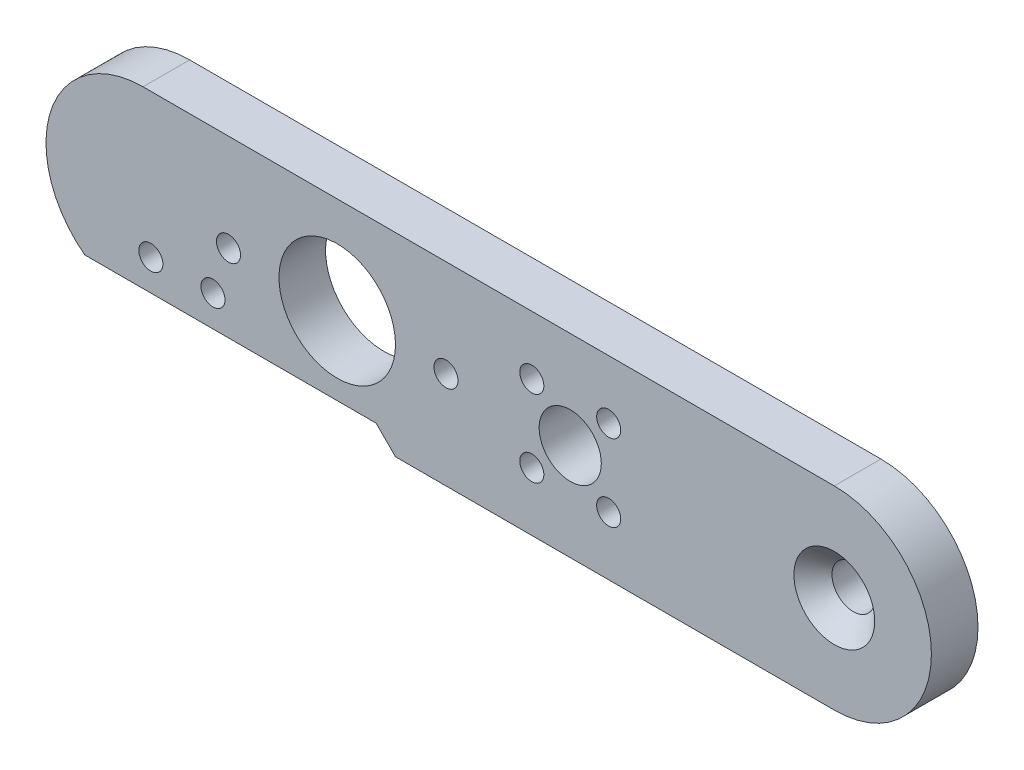
from build123d import *

# Parameters (mm, degrees)
SKETCH1_R                                       = 4
SKETCH1_R_2                                     = 1.55
SKETCH1_R_3                                     = 7.5
BOSS_EXTRUDE1_DEPTH                             = 6
CSK_FOR_M5_FLAT_HEAD_MACHINE_SCREW1_D           = 5.5
CSK_FOR_M5_FLAT_HEAD_MACHINE_SCREW1_CSINK_D     = 10.4
CSK_FOR_M5_FLAT_HEAD_MACHINE_SCREW1_CSINK_ANGLE = 90
SKETCH4_R                                       = 1.55
SKETCH4_R_2                                     = 7.5
CUT_EXTRUDE1_DEPTH                              = 59.662168388
SKETCH6_R                                       = 3
CUT_EXTRUDE3_DEPTH                              = 3


with BuildPart() as part:
    # Sketch1 → Boss-Extrude1 (new body)
    with BuildSketch(Plane.XY):
        with BuildLine():
            Line((-44.5, 12.5), (44.5, 12.5))
            ThreePointArc((44.5, 12.5), (57, 0), (44.5, -12.5))
            Line((44.5, -12.5), (-12, -12.5))
            Line((-12, -12.5), (-14.5, -10))
            Line((-14.5, -10), (-52, -10))
            ThreePointArc((-52, -10), (-56.358541226, 3.952847075), (-44.5, 12.5))
        make_face()
        with Locations((10.5, 0)):
            Circle(SKETCH1_R, mode=Mode.SUBTRACT)
        with Locations((15.449747468, 4.949747468)):
            Circle(SKETCH1_R_2, mode=Mode.SUBTRACT)
        with Locations(Location((5.550252532, 4.949747468, 0), (0, 0, 180))):
            Circle(SKETCH1_R_2, mode=Mode.SUBTRACT)
        with Locations((5.550252532, -4.949747468)):
            Circle(SKETCH1_R_2, mode=Mode.SUBTRACT)
        with Locations((15.449747468, -4.949747468)):
            Circle(SKETCH1_R_2, mode=Mode.SUBTRACT)
        with Locations((-33.5, 0)):
            Circle(SKETCH1_R_2, mode=Mode.SUBTRACT)
        with Locations((-19.5, 0)):
            Circle(SKETCH1_R_3, mode=Mode.SUBTRACT)
        with Locations((-5.5, 0)):
            Circle(SKETCH1_R_2, mode=Mode.SUBTRACT)
    extrude(amount=BOSS_EXTRUDE1_DEPTH)

    # CSK for M5 Flat Head Machine Screw1 (through all)
    with Locations(Plane.XY.offset(6)):
        with Locations((44.5, 0)):
            CounterSinkHole(CSK_FOR_M5_FLAT_HEAD_MACHINE_SCREW1_D / 2, CSK_FOR_M5_FLAT_HEAD_MACHINE_SCREW1_CSINK_D / 2, counter_sink_angle=CSK_FOR_M5_FLAT_HEAD_MACHINE_SCREW1_CSINK_ANGLE)

    # Sketch4 → Cut-Extrude1 (cut, through all)
    with BuildSketch(Plane.XY.offset(6)):
        with Locations((-43.5, -6)):
            Circle(SKETCH4_R)
        with Locations((-35.5, -6)):
            Circle(SKETCH4_R)
        with Locations((-19.5, 0)):
            Circle(SKETCH4_R_2)
    extrude(amount=-CUT_EXTRUDE1_DEPTH, mode=Mode.SUBTRACT)

    # Sketch6 → Cut-Extrude3 (cut)
    with BuildSketch(Plane(origin=(0, 0, 0), x_dir=(-1, 0, 0), z_dir=(0, 0, -1))):
        with Locations((43.5, -6)):
            Circle(SKETCH6_R)
        with Locations((35.5, -6)):
            Circle(SKETCH6_R)
    extrude(amount=-CUT_EXTRUDE3_DEPTH, mode=Mode.SUBTRACT)


solid = part.part
